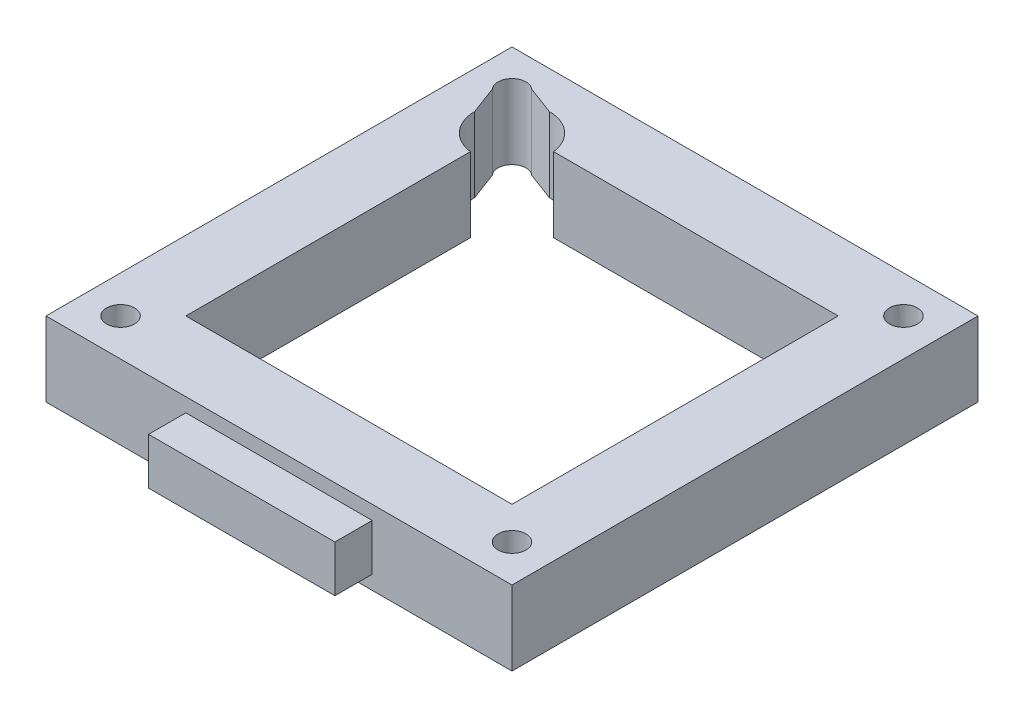
from build123d import *

# Parameters (mm, degrees)
SKETCH1_W         = 50
SKETCH1_H         = 50
SKETCH1_R         = 1.5
SUPPORT_DEPTH     = 8
NORTH_START       = -25
SKETCH2_W         = 20
SKETCH2_H         = 5
NORTH_CUT_DEPTH   = 4
SOUTH_START       = 25
SKETCH2_2_W       = 20
SKETCH2_2_H       = 5
SOUTH_DOWEL_DEPTH = 4
WEST_START        = -25
SKETCH3_W         = 20
SKETCH3_H         = 5
WEST_CUT_DEPTH    = 4


with BuildPart() as part:
    # Sketch1 → Support (new body)
    with BuildSketch(Plane(origin=(0, 0, 0), x_dir=(1, 0, 0), z_dir=(0, 1, 0))):
        Rectangle(SKETCH1_W, SKETCH1_H)
        with Locations(Location((-21, -21, 0), (0, 0, 270))):
            Circle(SKETCH1_R, mode=Mode.SUBTRACT)
        with Locations(Location((21, -21, 0), (0, 0, 270))):
            Circle(SKETCH1_R, mode=Mode.SUBTRACT)
        with BuildLine():
            Line((-13.031373033, 17.5), (17.5, 17.5))
            Line((17.5, 17.5), (17.5, -17.5))
            Line((17.5, -17.5), (-17.5, -17.5))
            Line((-17.5, -17.5), (-17.5, 13.031373033))
            ThreePointArc((-17.5, 13.031373033), (-20, 14.354248689), (-21, 17))
            Line((-21, 17), (-22.130136986, 20.01369863))
            ThreePointArc((-22.130136986, 20.01369863), (-22.060660172, 22.060660172), (-20.01369863, 22.130136986))
            Line((-20.01369863, 22.130136986), (-17, 21))
            ThreePointArc((-17, 21), (-14.354248689, 20), (-13.031373033, 17.5))
        make_face(mode=Mode.SUBTRACT)
        with Locations(Location((21, 21, 0), (0, 0, 270))):
            Circle(SKETCH1_R, mode=Mode.SUBTRACT)
    extrude(amount=SUPPORT_DEPTH)

    # Sketch2 → North Cut (cut)
    with BuildSketch(Plane.XY.offset(NORTH_START)):
        with Locations((0, 4)):
            Rectangle(SKETCH2_W, SKETCH2_H)
    extrude(amount=NORTH_CUT_DEPTH, mode=Mode.SUBTRACT)

    # Sketch2<2> → South Dowel (add)
    with BuildSketch(Plane.XY.offset(SOUTH_START)):
        with Locations((0, 4)):
            Rectangle(SKETCH2_2_W, SKETCH2_2_H)
    extrude(amount=SOUTH_DOWEL_DEPTH)

    # Sketch3 → West Cut (cut)
    with BuildSketch(Plane(origin=(0, 0, 0), x_dir=(0, 0, -1), z_dir=(1, 0, 0)).offset(WEST_START)):
        with Locations((0, 4)):
            Rectangle(SKETCH3_W, SKETCH3_H)
    extrude(amount=WEST_CUT_DEPTH, mode=Mode.SUBTRACT)


solid = part.part
